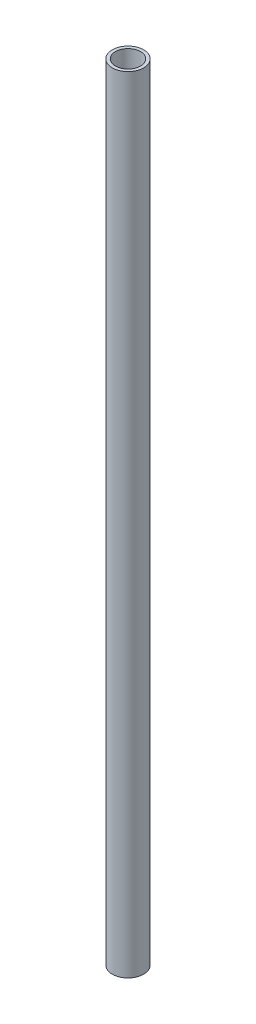
from build123d import *

# Parameters (mm, degrees)
SKETCH1_R           = 5
SKETCH1_R_2         = 4
BOSS_EXTRUDE1_DEPTH = 125


with BuildPart() as part:
    # Sketch1 → Boss-Extrude1 (new, symmetric)
    with BuildSketch(Plane(origin=(0, 0, 0), x_dir=(1, 0, 0), z_dir=(0, 1, 0))):
        with Locations(Location((0, 0, 0), (0, 0, 270))):
            Circle(SKETCH1_R)
        with Locations(Location((0, 0, 0), (0, 0, 270))):
            Circle(SKETCH1_R_2, mode=Mode.SUBTRACT)
    extrude(amount=BOSS_EXTRUDE1_DEPTH, both=True)


solid = part.part
